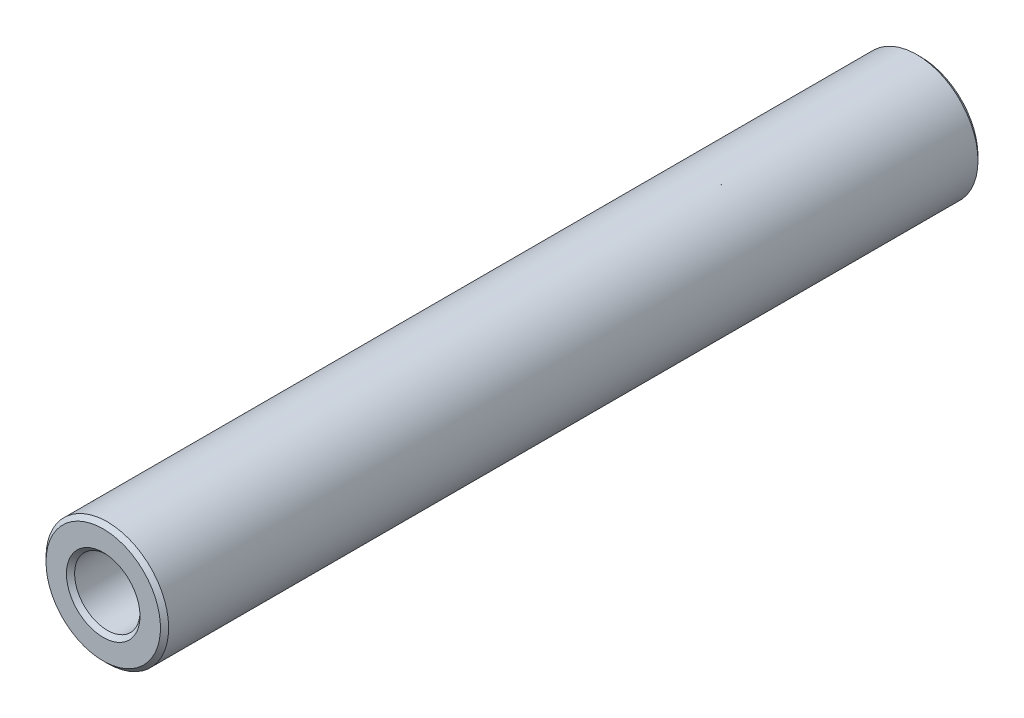
from build123d import *

# Parameters (mm, degrees)
SKETCH_1_W     = 40
SKETCH_1_H     = 1.4
CHAMFER_1_SIZE = 0.2


with BuildPart() as part:
    # ｽｹｯﾁ1 → 回転1 (revolve)
    with BuildSketch(Plane(origin=(0, 0, 0), x_dir=(0, 0, -1), z_dir=(1, 0, 0)), mode=Mode.PRIVATE) as revolve_1_sk:
        with Locations((0, 2.3)):
            Rectangle(SKETCH_1_W, SKETCH_1_H)
    revolve(revolve_1_sk.sketch.rotate(Axis((0, 0, 7.128099174), (0, 0, -1)), 90), axis=Axis((0, 0, 7.128099174), (0, 0, -1)))

    # 面取り1
    chamfer_1_edges = [part.edges().sort_by_distance(p)[0] for p in [
        (-3, 0, 20),
        (-3, 0, -20),
        (-1.6, 0, -20),
        (-1.6, 0, 20),
    ]]
    chamfer(chamfer_1_edges, length=CHAMFER_1_SIZE)


solid = part.part
